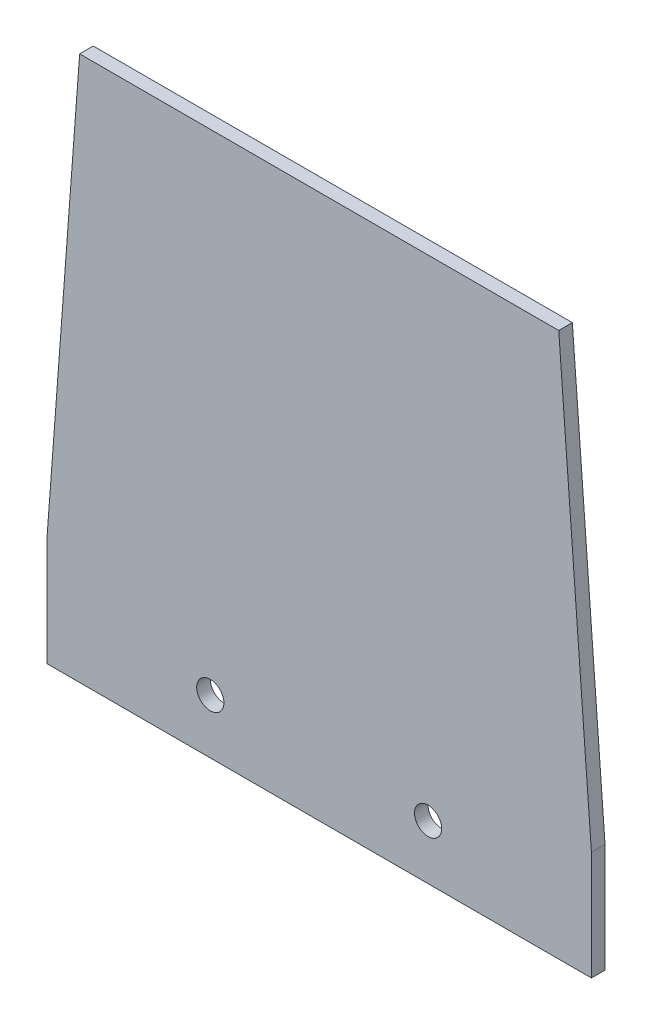
from build123d import *

# Parameters (mm, degrees)
SKETCH1_W           = 127
SKETCH1_H           = 25.4
BOSS_EXTRUDE1_DEPTH = 3.175
SKETCH2_R           = 3.175
CUT_EXTRUDE1_DEPTH  = 3.175


with BuildPart() as part:
    # Sketch1 → Boss-Extrude1 (new body)
    with BuildSketch(Plane.XY):
        Polygon((55.88, 25.4), (63.5, -76.2), (-63.5, -76.2), (-55.88, 25.4), align=None)
        with Locations((0, -88.9)):
            Rectangle(SKETCH1_W, SKETCH1_H)
    extrude(amount=BOSS_EXTRUDE1_DEPTH)

    # Sketch2 → Cut-Extrude1 (cut)
    with BuildSketch(Plane.XY.offset(3.175)):
        with Locations((-25.4, -88.9)):
            Circle(SKETCH2_R)
        with Locations((25.4, -88.9)):
            Circle(SKETCH2_R)
    extrude(amount=-CUT_EXTRUDE1_DEPTH, mode=Mode.SUBTRACT)


solid = part.part
